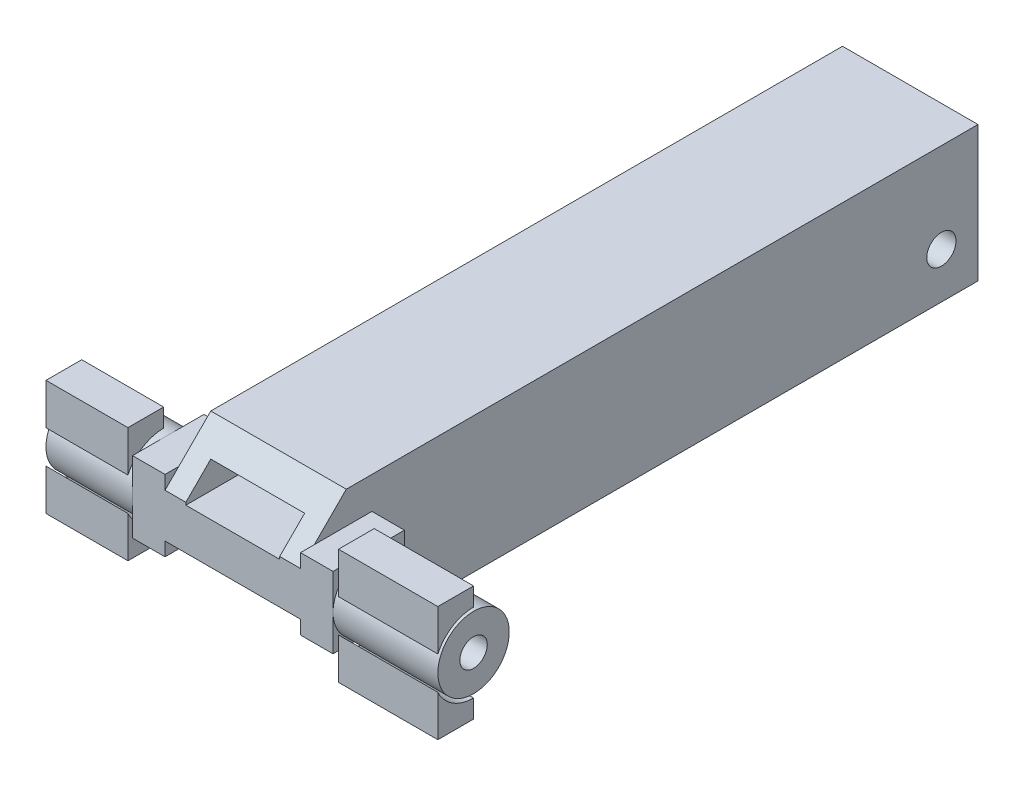
from build123d import *

# Parameters (mm, degrees)
SKETCH_1_W            = 74
SKETCH_1_H            = 14.8
EXTRUDE_1_DEPTH       = 14.8
SKETCH_2_W            = 10.25
SKETCH_2_H            = 10.25
CUT_EXTRUDE_1_DEPTH   = 65
SKETCH_3_R            = 3.9
EXTRUDE_2_DEPTH       = 15
EXTRUDE_START         = 13
SKETCH_4_R            = 3.9
EXTRUDE_3_DEPTH       = 13
CHAMFER_1_SIZE        = 5
SKETCH_8_R            = 1.45
CUT_EXTRUDE_4_DEPTH   = 58.057865365
SKETCH_9_W            = 7.8
SKETCH_9_H            = 7.8
SKETCH_9_R            = 1.5
EXTRUDE_4_DEPTH       = 3.55
SKETCH_10_W           = 7.8
SKETCH_10_H           = 7.8
EXTRUDE_5_DEPTH       = 3.55
SKETCH1_R             = 1.6
CUT_EXTRUDE1_DEPTH    = 49.08118135
SKETCH2_R             = 1.5
CUT_EXTRUDE2_DEPTH    = 58.057865365
SKETCH3_W             = 10.25
SKETCH3_H             = 3
CUT_EXTRUDE3_DEPTH    = 72.887411972
BOSS_EXTRUDE1_DEPTH   = 8.95
BOSS_EXTRUDE1_2_DEPTH = 8.95
BOSS_EXTRUDE7_START   = 23
BOSS_EXTRUDE7_DEPTH   = 10.85
BOSS_EXTRUDE7_2_DEPTH = 10.85


with BuildPart() as part:
    # Эскиз1 → Бобышка-Вытянуть1 (new body)
    with BuildSketch(Plane(origin=(0, 0, 0), x_dir=(0, 0, -1), z_dir=(1, 0, 0))):
        Rectangle(SKETCH_1_W, SKETCH_1_H)
    extrude(amount=EXTRUDE_1_DEPTH)

    # Эскиз2 → Вырез-Вытянуть1 (cut)
    with BuildSketch(Plane(origin=(0, 0, -37), x_dir=(-1, 0, 0), z_dir=(0, 0, -1))):
        with Locations((-7.4, 0)):
            Rectangle(SKETCH_2_W, SKETCH_2_H)
    extrude(amount=-CUT_EXTRUDE_1_DEPTH, mode=Mode.SUBTRACT)

    # Эскиз3 → Бобышка-Вытянуть2 (add)
    with BuildSketch(Plane(origin=(14.8, 0, 0), x_dir=(0, 0, -1), z_dir=(1, 0, 0))):
        with Locations(Location((-33.1, 0, 0), (0, 0, 180))):
            Circle(SKETCH_3_R)
    extrude(amount=EXTRUDE_2_DEPTH)

    # Эскиз4 → Бобышка-Вытянуть3 (add)
    with BuildSketch(Plane.ZY.offset(EXTRUDE_START)):
        with Locations((33.1, 0)):
            Circle(SKETCH_4_R)
    extrude(amount=-EXTRUDE_3_DEPTH)

    # Фаска1
    chamfer_1_edges = [part.edges().sort_by_distance(p)[0] for p in [
        (7.4, 7.4, 37),
        (7.4, -7.4, 37),
    ]]
    chamfer(chamfer_1_edges, length=CHAMFER_1_SIZE)

    # Эскиз8 → Вырез-Вытянуть4 (cut, through all)
    with BuildSketch(Plane(origin=(29.8, 0, 0), x_dir=(0, 0, -1), z_dir=(1, 0, 0))):
        with Locations((-33.1, 0)):
            Circle(SKETCH_8_R)
    extrude(amount=-CUT_EXTRUDE_4_DEPTH, mode=Mode.SUBTRACT)

    # Эскиз9 → Бобышка-Вытянуть4 (add)
    with BuildSketch(Plane.ZY):
        with Locations((33.1, 0)):
            Rectangle(SKETCH_9_W, SKETCH_9_H)
        with Locations((33.1, 0)):
            Circle(SKETCH_9_R, mode=Mode.SUBTRACT)
    extrude(amount=EXTRUDE_4_DEPTH)

    # Эскиз10 → Бобышка-Вытянуть5 (add)
    with BuildSketch(Plane(origin=(14.8, 0, 0), x_dir=(0, 0, -1), z_dir=(1, 0, 0))):
        with Locations((-33.1, 0)):
            Rectangle(SKETCH_10_W, SKETCH_10_H)
    extrude(amount=EXTRUDE_5_DEPTH)

    # Sketch1 → Cut-Extrude1 (cut, through all)
    with BuildSketch(Plane.ZY):
        with Locations((-33, -2.4)):
            Circle(SKETCH1_R)
    extrude(amount=-CUT_EXTRUDE1_DEPTH, mode=Mode.SUBTRACT)

    # Sketch2 → Cut-Extrude2 (cut, through all)
    with BuildSketch(Plane(origin=(29.8, 0, 0), x_dir=(0, 0, -1), z_dir=(1, 0, 0))):
        with Locations((-33.1, 0)):
            Circle(SKETCH2_R)
    extrude(amount=-CUT_EXTRUDE2_DEPTH, mode=Mode.SUBTRACT)

    # Sketch3 → Cut-Extrude3 (cut, through all)
    with BuildSketch(Plane(origin=(0, 0, 28), x_dir=(-1, 0, 0), z_dir=(0, 0, -1))):
        with Locations((-7.4, 3.625)):
            Rectangle(SKETCH3_W, SKETCH3_H)
    extrude(amount=-CUT_EXTRUDE3_DEPTH, mode=Mode.SUBTRACT)


with BuildPart() as body_2:
    # Sketch4 → Boss-Extrude1 (new body)
    with BuildSketch(Plane.ZY.offset(13)):
        with BuildLine():
            Line((33.1, 4.3), (33.1, 6.3))
            Line((33.1, 6.3), (37, 6.3))
            Line((37, 6.3), (37, 1.811077028))
            ThreePointArc((37, 1.811077028), (35.413262715, 3.62475042), (33.1, 4.3))
        make_face()
    extrude(amount=-BOSS_EXTRUDE1_DEPTH)


with BuildPart() as body_3:
    # Sketch4 → Boss-Extrude1 2 (new body)
    with BuildSketch(Plane.ZY.offset(13)):
        with BuildLine():
            Line((37, -6.3), (33.1, -6.3))
            Line((33.1, -6.3), (33.1, -4.3))
            ThreePointArc((33.1, -4.3), (35.413262715, -3.62475042), (37, -1.811077028))
            Line((37, -1.811077028), (37, -6.3))
        make_face()
    extrude(amount=-BOSS_EXTRUDE1_2_DEPTH)


with BuildPart() as body_4:
    # Sketch8 → Boss-Extrude7 (new body)
    with BuildSketch(Plane(origin=(-4.05, 0, 0), x_dir=(0, 0, -1), z_dir=(1, 0, 0)).offset(BOSS_EXTRUDE7_START)):
        with BuildLine():
            Line((-33.1, -4.3), (-33.1, -6.3))
            Line((-33.1, -6.3), (-37, -6.3))
            Line((-37, -6.3), (-37, -1.811077028))
            ThreePointArc((-37, -1.811077028), (-35.413262715, -3.62475042), (-33.1, -4.3))
        make_face()
    extrude(amount=BOSS_EXTRUDE7_DEPTH)


with BuildPart() as body_5:
    # Sketch8 → Boss-Extrude7 2 (new body)
    with BuildSketch(Plane(origin=(-4.05, 0, 0), x_dir=(0, 0, -1), z_dir=(1, 0, 0)).offset(BOSS_EXTRUDE7_START)):
        with BuildLine():
            Line((-33.1, 4.3), (-33.1, 6.3))
            Line((-33.1, 6.3), (-37, 6.3))
            Line((-37, 6.3), (-37, 1.811077028))
            ThreePointArc((-37, 1.811077028), (-35.413262715, 3.62475042), (-33.1, 4.3))
        make_face()
    extrude(amount=BOSS_EXTRUDE7_2_DEPTH)


solid = Compound([part.part, body_2.part, body_3.part, body_4.part, body_5.part])
